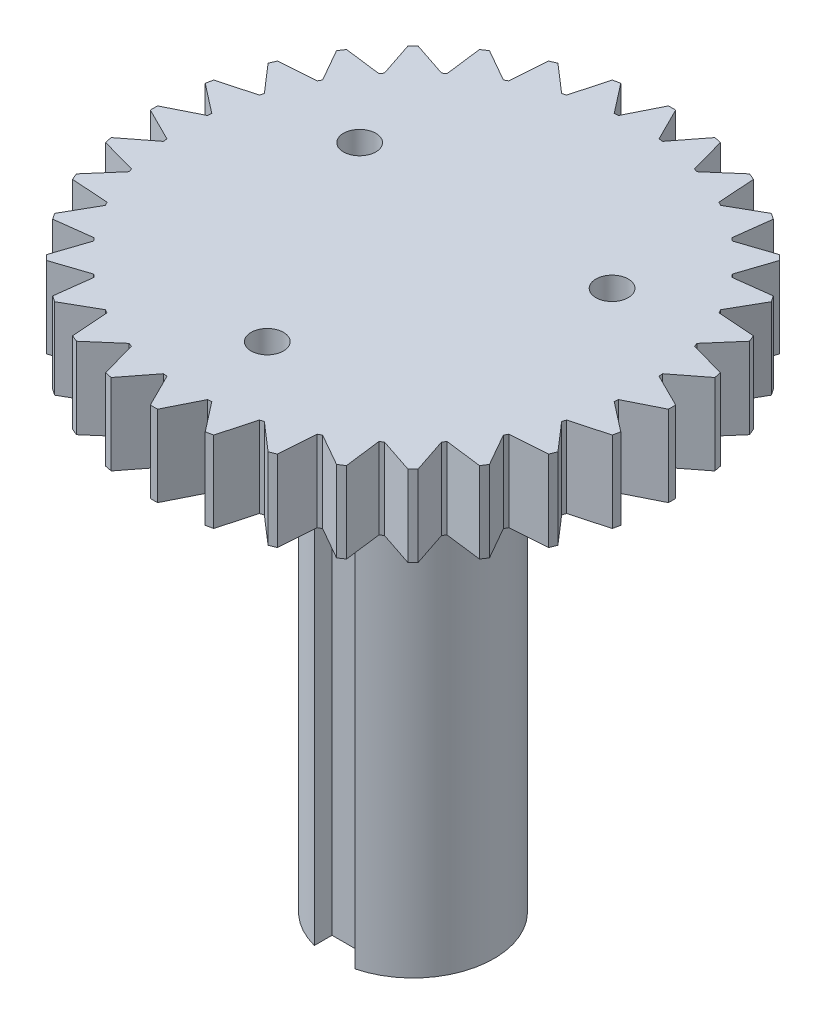
from build123d import *

# Parameters (mm, degrees)
BOSS_EXTRUDE1_DEPTH = 6.35
SKETCH2_OUTSIDE_W   = 55.65
SKETCH2_OUTSIDE_H   = 55.65
SKETCH2_OUTSIDE_R   = 20.32
CUT_EXTRUDE1_DEPTH  = 31.209342606
BOSS_EXTRUDE2_DEPTH = 38.1
CUT_EXTRUDE3_DEPTH  = 2.54
SKETCH7_R           = 1.27
CUT_EXTRUDE4_DEPTH  = 50.773631573
CIRPATTERN2_COUNT   = 3


with BuildPart() as part:
    # Sketch1 → Boss-Extrude1 (new body)
    with BuildSketch(Plane(origin=(0, 0, 0), x_dir=(1, 0, 0), z_dir=(0, 1, 0))):
        with BuildLine():
            Line((0, 20.883987655), (1.5875, 17.708987655))
            ThreePointArc((1.5875, 17.708987655), (1.742744755, 17.69438444), (1.897855471, 17.678420309))
            Line((1.897855471, 17.678420309), (4.074263877, 20.482707688))
            Line((4.074263877, 20.482707688), (5.011848737, 17.059008536))
            ThreePointArc((5.011848737, 17.059008536), (5.161261562, 17.014399169), (5.310277422, 16.968481184))
            Line((5.310277422, 16.968481184), (7.991956077, 19.294288751))
            Line((7.991956077, 19.294288751), (8.243594937, 15.753461287))
            ThreePointArc((8.243594937, 15.753461287), (8.381433981, 15.68056008), (8.518628388, 15.606452844))
            Line((8.518628388, 15.606452844), (11.602521888, 17.364401118))
            Line((11.602521888, 17.364401118), (11.158544407, 13.842517355))
            ThreePointArc((11.158544407, 13.842517355), (11.279512592, 13.744125861), (11.399613243, 13.644677274))
            Line((11.399613243, 13.644677274), (14.767209289, 14.767209289))
            Line((14.767209289, 14.767209289), (13.644677274, 11.399613243))
            ThreePointArc((13.644677274, 11.399613243), (13.744125861, 11.279512592), (13.842517355, 11.158544407))
            Line((13.842517355, 11.158544407), (17.364401118, 11.602521888))
            Line((17.364401118, 11.602521888), (15.606452844, 8.518628388))
            ThreePointArc((15.606452844, 8.518628388), (15.68056008, 8.381433981), (15.753461287, 8.243594937))
            Line((15.753461287, 8.243594937), (19.294288751, 7.991956077))
            Line((19.294288751, 7.991956077), (16.968481184, 5.310277422))
            ThreePointArc((16.968481184, 5.310277422), (17.014399169, 5.161261562), (17.059008536, 5.011848737))
            Line((17.059008536, 5.011848737), (20.482707688, 4.074263877))
            Line((20.482707688, 4.074263877), (17.678420309, 1.897855471))
            ThreePointArc((17.678420309, 1.897855471), (17.69438444, 1.742744755), (17.708987655, 1.5875))
            Line((17.708987655, 1.5875), (20.883987655, 0))
            Line((20.883987655, 0), (17.708987655, -1.5875))
            ThreePointArc((17.708987655, -1.5875), (17.69438444, -1.742744755), (17.678420309, -1.897855471))
            Line((17.678420309, -1.897855471), (20.482707688, -4.074263877))
            Line((20.482707688, -4.074263877), (17.059008536, -5.011848737))
            ThreePointArc((17.059008536, -5.011848737), (17.014399169, -5.161261562), (16.968481184, -5.310277422))
            Line((16.968481184, -5.310277422), (19.294288751, -7.991956077))
            Line((19.294288751, -7.991956077), (15.753461287, -8.243594937))
            ThreePointArc((15.753461287, -8.243594937), (15.68056008, -8.381433981), (15.606452844, -8.518628388))
            Line((15.606452844, -8.518628388), (17.364401118, -11.602521888))
            Line((17.364401118, -11.602521888), (13.842517355, -11.158544407))
            ThreePointArc((13.842517355, -11.158544407), (13.744125861, -11.279512592), (13.644677274, -11.399613243))
            Line((13.644677274, -11.399613243), (14.767209289, -14.767209289))
            Line((14.767209289, -14.767209289), (11.399613243, -13.644677274))
            ThreePointArc((11.399613243, -13.644677274), (11.279512592, -13.744125861), (11.158544407, -13.842517355))
            Line((11.158544407, -13.842517355), (11.602521888, -17.364401118))
            Line((11.602521888, -17.364401118), (8.518628388, -15.606452844))
            ThreePointArc((8.518628388, -15.606452844), (8.381433981, -15.68056008), (8.243594937, -15.753461287))
            Line((8.243594937, -15.753461287), (7.991956077, -19.294288751))
            Line((7.991956077, -19.294288751), (5.310277422, -16.968481184))
            ThreePointArc((5.310277422, -16.968481184), (5.161261562, -17.014399169), (5.011848737, -17.059008536))
            Line((5.011848737, -17.059008536), (4.074263877, -20.482707688))
            Line((4.074263877, -20.482707688), (1.897855471, -17.678420309))
            ThreePointArc((1.897855471, -17.678420309), (1.742744755, -17.69438444), (1.5875, -17.708987655))
            Line((1.5875, -17.708987655), (0, -20.883987655))
            Line((0, -20.883987655), (-1.5875, -17.708987655))
            ThreePointArc((-1.5875, -17.708987655), (-1.742744755, -17.69438444), (-1.897855471, -17.678420309))
            Line((-1.897855471, -17.678420309), (-4.074263877, -20.482707688))
            Line((-4.074263877, -20.482707688), (-5.011848737, -17.059008536))
            ThreePointArc((-5.011848737, -17.059008536), (-5.161261562, -17.014399169), (-5.310277422, -16.968481184))
            Line((-5.310277422, -16.968481184), (-7.991956077, -19.294288751))
            Line((-7.991956077, -19.294288751), (-8.243594937, -15.753461287))
            ThreePointArc((-8.243594937, -15.753461287), (-8.381433981, -15.68056008), (-8.518628388, -15.606452844))
            Line((-8.518628388, -15.606452844), (-11.602521888, -17.364401118))
            Line((-11.602521888, -17.364401118), (-11.158544407, -13.842517355))
            ThreePointArc((-11.158544407, -13.842517355), (-11.279512592, -13.744125861), (-11.399613243, -13.644677274))
            Line((-11.399613243, -13.644677274), (-14.767209289, -14.767209289))
            Line((-14.767209289, -14.767209289), (-13.644677274, -11.399613243))
            ThreePointArc((-13.644677274, -11.399613243), (-13.744125861, -11.279512592), (-13.842517355, -11.158544407))
            Line((-13.842517355, -11.158544407), (-17.364401118, -11.602521888))
            Line((-17.364401118, -11.602521888), (-15.606452844, -8.518628388))
            ThreePointArc((-15.606452844, -8.518628388), (-15.68056008, -8.381433981), (-15.753461287, -8.243594937))
            Line((-15.753461287, -8.243594937), (-19.294288751, -7.991956077))
            Line((-19.294288751, -7.991956077), (-16.968481184, -5.310277422))
            ThreePointArc((-16.968481184, -5.310277422), (-17.014399169, -5.161261562), (-17.059008536, -5.011848737))
            Line((-17.059008536, -5.011848737), (-20.482707688, -4.074263877))
            Line((-20.482707688, -4.074263877), (-17.678420309, -1.897855471))
            ThreePointArc((-17.678420309, -1.897855471), (-17.69438444, -1.742744755), (-17.708987655, -1.5875))
            Line((-17.708987655, -1.5875), (-20.883987655, 0))
            Line((-20.883987655, 0), (-17.708987655, 1.5875))
            ThreePointArc((-17.708987655, 1.5875), (-17.69438444, 1.742744755), (-17.678420309, 1.897855471))
            Line((-17.678420309, 1.897855471), (-20.482707688, 4.074263877))
            Line((-20.482707688, 4.074263877), (-17.059008536, 5.011848737))
            ThreePointArc((-17.059008536, 5.011848737), (-17.014399169, 5.161261562), (-16.968481184, 5.310277422))
            Line((-16.968481184, 5.310277422), (-19.294288751, 7.991956077))
            Line((-19.294288751, 7.991956077), (-15.753461287, 8.243594937))
            ThreePointArc((-15.753461287, 8.243594937), (-15.68056008, 8.381433981), (-15.606452844, 8.518628388))
            Line((-15.606452844, 8.518628388), (-17.364401118, 11.602521888))
            Line((-17.364401118, 11.602521888), (-13.842517355, 11.158544407))
            ThreePointArc((-13.842517355, 11.158544407), (-13.744125861, 11.279512592), (-13.644677274, 11.399613243))
            Line((-13.644677274, 11.399613243), (-14.767209289, 14.767209289))
            Line((-14.767209289, 14.767209289), (-11.399613243, 13.644677274))
            ThreePointArc((-11.399613243, 13.644677274), (-11.279512592, 13.744125861), (-11.158544407, 13.842517355))
            Line((-11.158544407, 13.842517355), (-11.602521888, 17.364401118))
            Line((-11.602521888, 17.364401118), (-8.518628388, 15.606452844))
            ThreePointArc((-8.518628388, 15.606452844), (-8.381433981, 15.68056008), (-8.243594937, 15.753461287))
            Line((-8.243594937, 15.753461287), (-7.991956077, 19.294288751))
            Line((-7.991956077, 19.294288751), (-5.310277422, 16.968481184))
            ThreePointArc((-5.310277422, 16.968481184), (-5.161261562, 17.014399169), (-5.011848737, 17.059008536))
            Line((-5.011848737, 17.059008536), (-4.074263877, 20.482707688))
            Line((-4.074263877, 20.482707688), (-1.897855471, 17.678420309))
            ThreePointArc((-1.897855471, 17.678420309), (-1.742744755, 17.69438444), (-1.5875, 17.708987655))
            Line((-1.5875, 17.708987655), (0, 20.883987655))
        make_face()
    extrude(amount=BOSS_EXTRUDE1_DEPTH)

    # Sketch2 outside → Cut-Extrude1 (cut, through all)
    with BuildSketch(Plane(origin=(0, 6.35, 0), x_dir=(-1, 0, 0), z_dir=(0, 1, 0))):
        Rectangle(SKETCH2_OUTSIDE_W, SKETCH2_OUTSIDE_H)
        Circle(SKETCH2_OUTSIDE_R, mode=Mode.SUBTRACT)
    extrude(amount=-CUT_EXTRUDE1_DEPTH, mode=Mode.SUBTRACT)

    # Sketch3 → Boss-Extrude2 (add)
    with BuildSketch(Plane.XZ):
        with BuildLine():
            Line((-1.5875, 4.7625), (1.5875, 4.7625))
            Line((1.5875, 4.7625), (1.5875, 6.148361062))
            ThreePointArc((1.5875, 6.148361062), (0, -6.35), (-1.5875, 6.148361062))
            Line((-1.5875, 6.148361062), (-1.5875, 4.7625))
        make_face()
    extrude(amount=BOSS_EXTRUDE2_DEPTH)

    # Sketch4 → Cut-Extrude3 (cut)
    with BuildSketch(Plane.XZ):
        Polygon((3.666174209, 11.43), (1.833087105, 14.605), (-1.833087105, 14.605), (-3.666174209, 11.43), (-1.833087105, 8.255), (1.833087105, 8.255), align=None)
    cut_extrude3 = extrude(amount=-CUT_EXTRUDE3_DEPTH, mode=Mode.SUBTRACT)

    # Sketch7 → Cut-Extrude4 (cut, through all)
    with BuildSketch(Plane.XZ.offset(-2.54)):
        with Locations(Location((0, 11.43, 0), (0, 0, 270))):
            Circle(SKETCH7_R)
    cut_extrude4 = extrude(amount=-CUT_EXTRUDE4_DEPTH, mode=Mode.SUBTRACT)

    # CirPattern2: Cut-Extrude3, Cut-Extrude4 ×3 about axis
    cirpattern2_axis = Axis((0, 0, 0), (0, 1, 0))
    add([cut_extrude3.rotate(cirpattern2_axis, i * 360 / CIRPATTERN2_COUNT) for i in range(1, CIRPATTERN2_COUNT)], mode=Mode.SUBTRACT)
    add([cut_extrude4.rotate(cirpattern2_axis, i * 360 / CIRPATTERN2_COUNT) for i in range(1, CIRPATTERN2_COUNT)], mode=Mode.SUBTRACT)


solid = part.part
